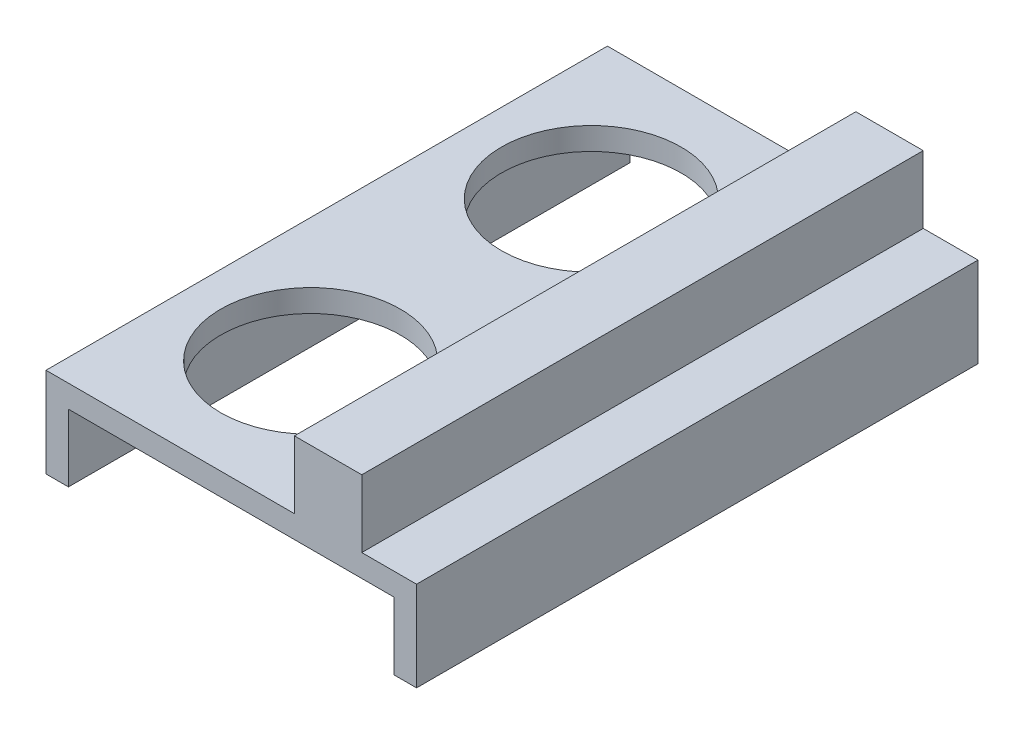
from build123d import *

# Parameters (mm, degrees)
SKETCH1_W           = 33
SKETCH1_H           = 50
BOSS_EXTRUDE1_DEPTH = 2
SKETCH2_W           = 2
SKETCH2_H           = 50
BOSS_EXTRUDE2_DEPTH = 6
BOSS_EXTRUDE3_DEPTH = 6
CUT_EXTRUDE1_DEPTH  = 6


with BuildPart() as part:
    # Sketch1 → Boss-Extrude1 (new body)
    with BuildSketch(Plane(origin=(0, 0, 0), x_dir=(1, 0, 0), z_dir=(0, 1, 0))):
        with Locations((-13.079672346, -6.364652574)):
            Rectangle(SKETCH1_W, SKETCH1_H)
    extrude(amount=BOSS_EXTRUDE1_DEPTH)

    # Sketch2 → Boss-Extrude2 (add)
    with BuildSketch(Plane.XZ):
        with Locations((-28.579672346, 6.364652574)):
            Rectangle(SKETCH2_W, SKETCH2_H)
        with Locations((2.420327654, 6.364652574)):
            Rectangle(SKETCH2_W, SKETCH2_H)
    extrude(amount=BOSS_EXTRUDE2_DEPTH)

    # Sketch3 → Boss-Extrude3 (add)
    with BuildSketch(Plane(origin=(0, 2, 0), x_dir=(1, 0, 0), z_dir=(0, 1, 0))):
        Polygon((-1.456888389, -6.364652574), (-4.456888389, -6.364652574), (-7.456888389, -6.364652574), (-7.456888389, -31.364652574), (-1.456888389, -31.364652574), align=None)
        Polygon((-7.456888389, -6.364652574), (-4.456888389, -6.364652574), (-1.456888389, -6.364652574), (-1.456888389, 18.635347426), (-7.456888389, 18.635347426), align=None)
    extrude(amount=BOSS_EXTRUDE3_DEPTH)

    # Sketch4 → Cut-Extrude1 (cut)
    with BuildSketch(Plane(origin=(0, 2, 0), x_dir=(1, 0, 0), z_dir=(0, 1, 0))):
        with BuildLine():
            ThreePointArc((-10.518280368, -18.864652574), (-12.861426118, -13.207798324), (-18.518280368, -10.864652574))
            Line((-18.518280368, -10.864652574), (-18.518280368, -26.864652574))
            ThreePointArc((-18.518280368, -26.864652574), (-12.861426118, -24.521506823), (-10.518280368, -18.864652574))
        make_face()
        with BuildLine():
            Line((-18.518280368, -26.864652574), (-18.518280368, -10.864652574))
            ThreePointArc((-18.518280368, -10.864652574), (-26.518280368, -18.864652574), (-18.518280368, -26.864652574))
        make_face()
        with BuildLine():
            ThreePointArc((-18.518280368, 14.135347426), (-26.518280368, 6.135347426), (-18.518280368, -1.864652574))
            Line((-18.518280368, -1.864652574), (-18.518280368, 14.135347426))
        make_face()
        with BuildLine():
            Line((-18.518280368, 14.135347426), (-18.518280368, -1.864652574))
            ThreePointArc((-18.518280368, -1.864652574), (-12.861426118, 0.478493177), (-10.518280368, 6.135347426))
            ThreePointArc((-10.518280368, 6.135347426), (-12.861426118, 11.792201676), (-18.518280368, 14.135347426))
        make_face()
    extrude(amount=-CUT_EXTRUDE1_DEPTH, mode=Mode.SUBTRACT)


solid = part.part
